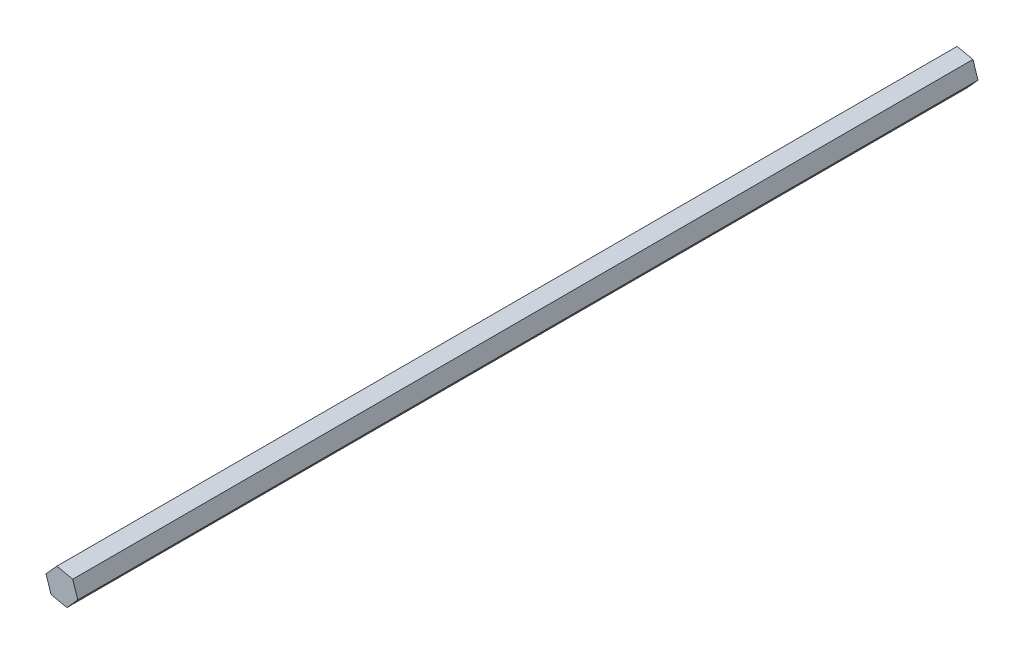
from build123d import *

# Parameters (mm, degrees)
BOSS_EXTRUDE1_DEPTH = 406.4


with BuildPart() as part:
    # Sketch1 → Boss-Extrude1 (new body)
    with BuildSketch(Plane.XY):
        Polygon((-5.998662383, -0.409001781), (-8.271087899, 6.562326328), (-15.444647898, 8.080012157), (-20.34578238, 2.626369878), (-18.073356864, -4.344958232), (-10.899796865, -5.862644061), align=None)
    extrude(amount=BOSS_EXTRUDE1_DEPTH)


solid = part.part
